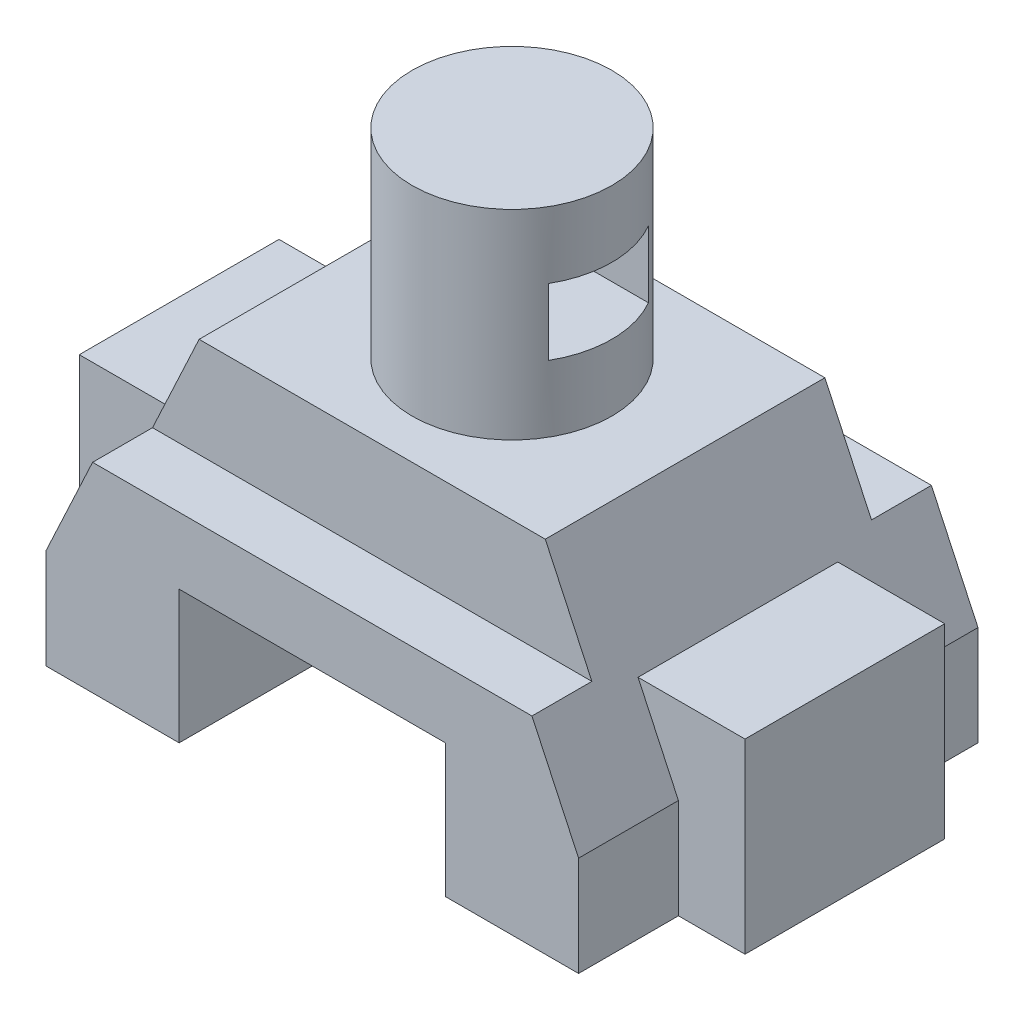
from build123d import *

# Parameters (mm, degrees)
BOSS_EXTRUDE1_DEPTH      = 60
SKETCH7_W                = 80
SKETCH7_H                = 9
CUT_EXTRUDE4_DEPTH       = 15
SKETCH8_R                = 15
BOSS_EXTRUDE2_DEPTH      = 30
BOSS_EXTRUDE3_DEPTH      = 90
BOSS_EXTRUDE3_DEPTH_BACK = 10
SKETCH10_W               = 30
SKETCH10_H               = 28
SKETCH12_W               = 40
SKETCH12_H               = 20
CUT_EXTRUDE5_DEPTH       = 90
CUT_EXTRUDE6_DEPTH       = 109.282039139
CUT_EXTRUDE6_DEPTH_BACK  = 109.282039139
SKETCH13_W               = 15
SKETCH13_H               = 10


with BuildPart() as part:
    # Sketch1 → Boss-Extrude1 (new body)
    with BuildSketch(Plane.XY):
        Polygon((40, 0), (20, 0), (20, 20), (-20, 20), (-20, 0), (-40, 0), (-40, 15), (-26, 45), (26, 45), (40, 15), align=None)
    extrude(amount=BOSS_EXTRUDE1_DEPTH)

    # Sketch7 → Cut-Extrude4 (cut)
    with BuildSketch(Plane(origin=(0, 45, 0), x_dir=(1, 0, 0), z_dir=(0, 1, 0))):
        with Locations((0, -4.5)):
            Rectangle(SKETCH7_W, SKETCH7_H)
        with Locations((0, -55.5)):
            Rectangle(SKETCH7_W, SKETCH7_H)
    extrude(amount=-CUT_EXTRUDE4_DEPTH, mode=Mode.SUBTRACT)

    # Sketch8 → Boss-Extrude2 (add)
    with BuildSketch(Plane(origin=(0, 45, 0), x_dir=(1, 0, 0), z_dir=(0, 1, 0))):
        with Locations(Location((0, -30, 0), (0, 0, 270))):
            Circle(SKETCH8_R)
    extrude(amount=BOSS_EXTRUDE2_DEPTH)

    # Sketch10 → Boss-Extrude3 (add, two sides: drawn at the far end of the back side and taken through both)
    with BuildSketch(Plane(origin=(-40, 0, 0), x_dir=(0, 0, -1), z_dir=(1, 0, 0)).offset(-BOSS_EXTRUDE3_DEPTH_BACK)):
        with Locations((-30, 14)):
            Rectangle(SKETCH10_W, SKETCH10_H)
    extrude(amount=BOSS_EXTRUDE3_DEPTH + BOSS_EXTRUDE3_DEPTH_BACK)

    # Sketch12 → Cut-Extrude5 (cut)
    with BuildSketch(Plane(origin=(0, 0, 15), x_dir=(-1, 0, 0), z_dir=(0, 0, -1))):
        with Locations((0, 10)):
            Rectangle(SKETCH12_W, SKETCH12_H)
    extrude(amount=-CUT_EXTRUDE5_DEPTH, mode=Mode.SUBTRACT)

    # Sketch13 → Cut-Extrude6 (cut, two sides: drawn at the far end of the back side and taken through both)
    with BuildSketch(Plane(origin=(0, 0, 0), x_dir=(0, 0, -1), z_dir=(1, 0, 0)).offset(-CUT_EXTRUDE6_DEPTH_BACK)):
        with Locations((-30, 60)):
            Rectangle(SKETCH13_W, SKETCH13_H)
    extrude(amount=CUT_EXTRUDE6_DEPTH + CUT_EXTRUDE6_DEPTH_BACK, mode=Mode.SUBTRACT)


solid = part.part
